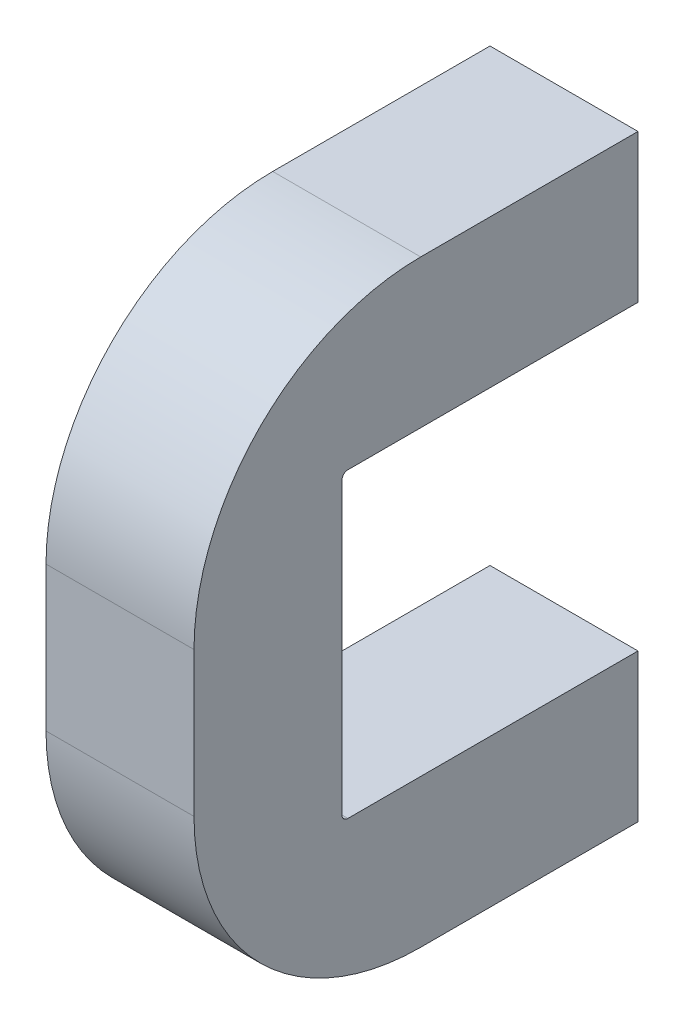
from build123d import *

# Parameters (mm, degrees)
SALIENTE_EXTRUIR1_DEPTH = 10
CORTAR_EXTRUIR1_DEPTH   = 4
REDONDEO2_R             = 1.5


with BuildPart() as part:
    # Croquis2 → Saliente-Extruir1 (new body)
    with BuildSketch(Plane(origin=(-2.525360123, 2.123276243, -2.466894012), x_dir=(0, 0, -1), z_dir=(1, 0, 0))):
        with BuildLine():
            Line((103.598862982, 173.647805519), (108.516020269, 173.647805519))
            Line((108.516020269, 173.647805519), (118.281705694, 173.647805519))
            Line((118.281705694, 173.647805519), (123.198862982, 173.647805519))
            Line((123.198862982, 173.647805519), (123.198862982, 183.647805519))
            Line((123.198862982, 183.647805519), (118.281705694, 183.647805519))
            Line((118.281705694, 183.647805519), (108.516020269, 183.647805519))
            ThreePointArc((108.516020269, 183.647805519), (97.685154483, 179.161514018), (93.198862982, 168.330648231))
            Line((93.198862982, 168.330648231), (93.198862982, 158.564962806))
            ThreePointArc((93.198862982, 158.564962806), (97.685154483, 147.73409702), (108.516020269, 143.247805519))
            Line((108.516020269, 143.247805519), (118.281705694, 143.247805519))
            Line((118.281705694, 143.247805519), (123.198862982, 143.247805519))
            Line((123.198862982, 143.247805519), (123.198862982, 153.247805519))
            Line((123.198862982, 153.247805519), (118.281705694, 153.247805519))
            Line((118.281705694, 153.247805519), (108.516020269, 153.247805519))
            Line((108.516020269, 153.247805519), (103.598862982, 153.247805519))
            ThreePointArc((103.598862982, 153.247805519), (103.316020269, 153.364962806), (103.198862982, 153.647805519))
            Line((103.198862982, 153.647805519), (103.198862982, 158.564962806))
            Line((103.198862982, 158.564962806), (103.198862982, 168.330648231))
            Line((103.198862982, 168.330648231), (103.198862982, 173.247805519))
            ThreePointArc((103.198862982, 173.247805519), (103.316020269, 173.530648231), (103.598862982, 173.647805519))
        make_face()
    extrude(amount=SALIENTE_EXTRUIR1_DEPTH)

    # Croquis3 → Cortar-Extruir1 (cut)
    with BuildSketch(Plane(origin=(0, 0, -126.865756994), x_dir=(-1, 0, 0), z_dir=(0, 0, -1))):
        with BuildLine():
            ThreePointArc((-5.322623748, 181.995413363), (-6.824639877, 180.771081761), (-5.322623748, 179.54675016))
            ThreePointArc((-5.322623748, 179.54675016), (0.625360123, 180.771081761), (-5.322623748, 181.995413363))
        make_face()
        with BuildLine():
            ThreePointArc((-5.322623748, 151.595413363), (-6.824639877, 150.371081761), (-5.322623748, 149.14675016))
            ThreePointArc((-5.322623748, 149.14675016), (0.625360123, 150.371081761), (-5.322623748, 151.595413363))
        make_face()
    extrude(amount=-CORTAR_EXTRUIR1_DEPTH, mode=Mode.SUBTRACT)

    # Redondeo2
    redondeo2_edges = [part.edges().sort_by_distance(p)[0] for p in [
        (5.322623748, 181.995413363, -124.265756994),
        (5.322623748, 179.54675016, -124.265756994),
        (5.322623748, 151.595413363, -124.265756994),
        (5.322623748, 149.14675016, -124.265756994),
    ]]
    fillet(redondeo2_edges, radius=REDONDEO2_R)


solid = part.part
